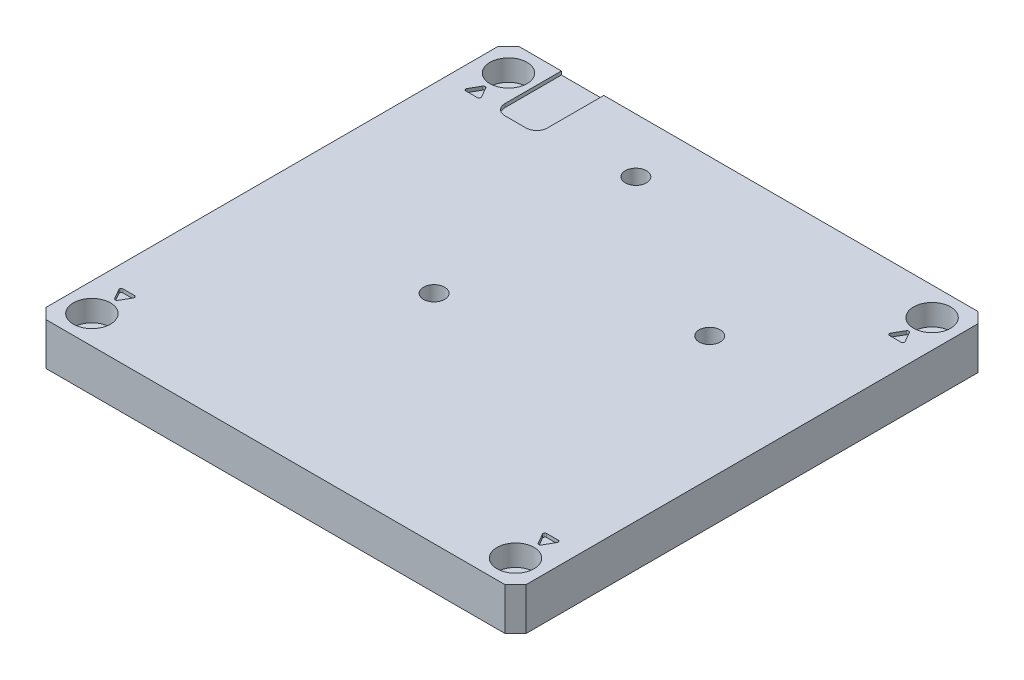
from build123d import *

# Parameters (mm, degrees)
SKETCH_2_W             = 136
SKETCH_2_H             = 134
SKETCH_2_R             = 3.1
SKETCH_2_R_2           = 3
EXTRUDE_1_DEPTH        = 12
SKETCH_3_R             = 5.25
CUT_EXTRUDE_1165_DEPTH = 6
SKETCH_4_W             = 12
SKETCH_4_H             = 20
CUT_EXTRUDE_2_DEPTH    = 1
CHAMFER_1_SIZE         = 3
FILLET_1_R             = 3


with BuildPart() as part:
    # ｽｹｯﾁ2 → ﾎﾞｽ - 押し出し1 (new body)
    with BuildSketch(Plane(origin=(0, 0, 0), x_dir=(1, 0, 0), z_dir=(0, 1, 0))):
        with Locations((0, -23)):
            Rectangle(SKETCH_2_W, SKETCH_2_H)
        with Locations(Location((-60, 36, 0), (0, 0, 270))):
            Circle(SKETCH_2_R, mode=Mode.SUBTRACT)
        with Locations(Location((60, 36, 0), (0, 0, 270))):
            Circle(SKETCH_2_R, mode=Mode.SUBTRACT)
        with Locations(Location((60, -82, 0), (0, 0, 270))):
            Circle(SKETCH_2_R, mode=Mode.SUBTRACT)
        with Locations(Location((-60, -82, 0), (0, 0, 270))):
            Circle(SKETCH_2_R, mode=Mode.SUBTRACT)
        with Locations(Location((-16.5, 28.578838325, 0), (0, 0, 270))):
            Circle(SKETCH_2_R_2, mode=Mode.SUBTRACT)
        with Locations(Location((-16.5, -28.578838325, 0), (0, 0, 270))):
            Circle(SKETCH_2_R_2, mode=Mode.SUBTRACT)
        with Locations(Location((33, 0, 0), (0, 0, 270))):
            Circle(SKETCH_2_R_2, mode=Mode.SUBTRACT)
    extrude(amount=EXTRUDE_1_DEPTH)

    # ｽｹｯﾁ3 → Cut-Extrude 1165 (cut)
    with BuildSketch(Plane(origin=(0, 12, 0), x_dir=(1, 0, 0), z_dir=(0, 1, 0))):
        with Locations(Location((-60, 36, 0), (0, 0, 270))):
            Circle(SKETCH_3_R)
        with Locations(Location((60, 36, 0), (0, 0, 270))):
            Circle(SKETCH_3_R)
        with Locations(Location((-60, -82, 0), (0, 0, 270))):
            Circle(SKETCH_3_R)
        with Locations(Location((60, -82, 0), (0, 0, 270))):
            Circle(SKETCH_3_R)
    extrude(amount=-CUT_EXTRUDE_1165_DEPTH, mode=Mode.SUBTRACT)

    # ｽｹｯﾁ4 → ｶｯﾄ - 押し出し2 (cut)
    with BuildSketch(Plane(origin=(0, 12, 0), x_dir=(1, 0, 0), z_dir=(0, 1, 0))):
        with BuildLine():
            Line((57.933012702, 26.306624327), (59.566987298, 29.136751346))
            ThreePointArc((59.566987298, 29.136751346), (60, 29.386751346), (60.433012702, 29.136751346))
            Line((60.433012702, 29.136751346), (62.066987298, 26.306624327))
            ThreePointArc((62.066987298, 26.306624327), (62.066987298, 25.806624327), (61.633974596, 25.556624327))
            Line((61.633974596, 25.556624327), (58.366025404, 25.556624327))
            ThreePointArc((58.366025404, 25.556624327), (57.933012702, 25.806624327), (57.933012702, 26.306624327))
        make_face()
        with BuildLine():
            Line((-60.433012702, 29.136751346), (-62.066987298, 26.306624327))
            ThreePointArc((-62.066987298, 26.306624327), (-62.066987298, 25.806624327), (-61.633974596, 25.556624327))
            Line((-61.633974596, 25.556624327), (-58.366025404, 25.556624327))
            ThreePointArc((-58.366025404, 25.556624327), (-57.933012702, 25.806624327), (-57.933012702, 26.306624327))
            Line((-57.933012702, 26.306624327), (-59.566987298, 29.136751346))
            ThreePointArc((-59.566987298, 29.136751346), (-60, 29.386751346), (-60.433012702, 29.136751346))
        make_face()
        with BuildLine():
            Line((60.433012702, -75.136751346), (62.066987298, -72.306624327))
            ThreePointArc((62.066987298, -72.306624327), (62.066987298, -71.806624327), (61.633974596, -71.556624327))
            Line((61.633974596, -71.556624327), (58.366025404, -71.556624327))
            ThreePointArc((58.366025404, -71.556624327), (57.933012702, -71.806624327), (57.933012702, -72.306624327))
            Line((57.933012702, -72.306624327), (59.566987298, -75.136751346))
            ThreePointArc((59.566987298, -75.136751346), (60, -75.386751346), (60.433012702, -75.136751346))
        make_face()
        with BuildLine():
            Line((-57.933012702, -72.306624327), (-59.566987298, -75.136751346))
            ThreePointArc((-59.566987298, -75.136751346), (-60, -75.386751346), (-60.433012702, -75.136751346))
            Line((-60.433012702, -75.136751346), (-62.066987298, -72.306624327))
            ThreePointArc((-62.066987298, -72.306624327), (-62.066987298, -71.806624327), (-61.633974596, -71.556624327))
            Line((-61.633974596, -71.556624327), (-58.366025404, -71.556624327))
            ThreePointArc((-58.366025404, -71.556624327), (-57.933012702, -71.806624327), (-57.933012702, -72.306624327))
        make_face()
        with Locations((-47, 35)):
            Rectangle(SKETCH_4_W, SKETCH_4_H)
    extrude(amount=-CUT_EXTRUDE_2_DEPTH, mode=Mode.SUBTRACT)

    # 面取り1
    chamfer_1_edges = [part.edges().sort_by_distance(p)[0] for p in [
        (-68, 6, -44),
        (68, 6, -44),
        (68, 6, 90),
        (-68, 6, 90),
    ]]
    chamfer(chamfer_1_edges, length=CHAMFER_1_SIZE)

    # ﾌｨﾚｯﾄ1
    fillet_1_edges = [part.edges().sort_by_distance(p)[0] for p in [
        (-53, 11.5, -25),
        (-41, 11.5, -25),
    ]]
    fillet(fillet_1_edges, radius=FILLET_1_R)


solid = part.part
